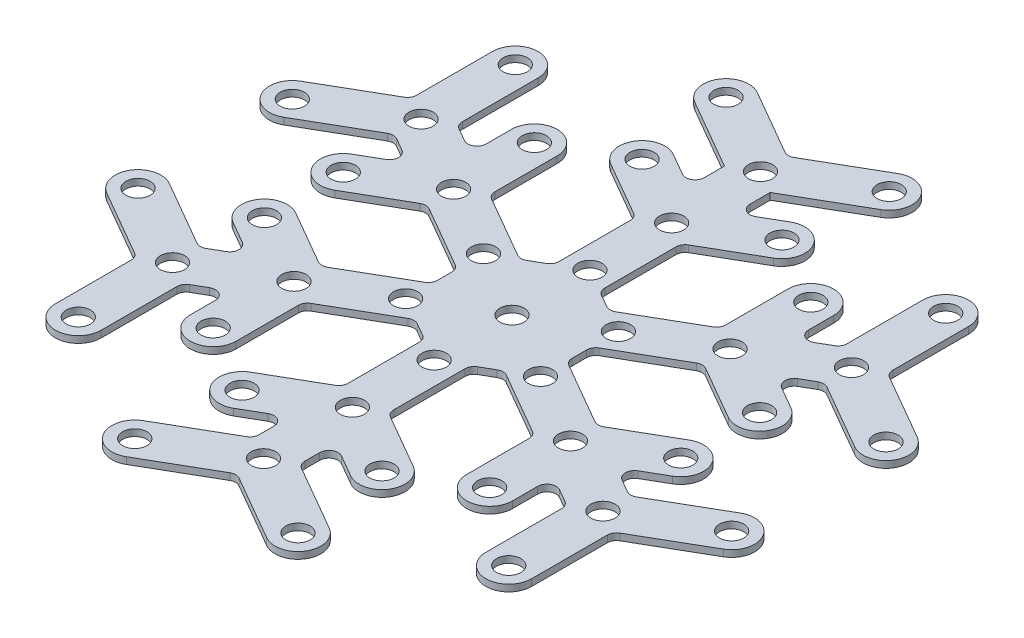
from build123d import *

# Parameters (mm, degrees)
SKETCH1_R           = 5.715
BOSS_EXTRUDE1_DEPTH = 3.175


with BuildPart() as part:
    # Sketch1 → Boss-Extrude1 (new body)
    with BuildSketch(Plane(origin=(0, 0, 0), x_dir=(1, 0, 0), z_dir=(0, 1, 0))):
        with BuildLine():
            Line((-33.097329198, 148.802026866), (-2.174864524, 130.948933563))
            ThreePointArc((-2.174864524, 130.948933563), (0, 130.36618037), (2.174864524, 130.948933563))
            Line((2.174864524, 130.948933563), (33.097329198, 148.802026866))
            ThreePointArc((33.097329198, 148.802026866), (47.843573432, 144.850782633), (43.892329198, 130.104538399))
            Line((43.892329198, 130.104538399), (10.795, 110.995786477))
            Line((10.795, 110.995786477), (10.795, 101.526203456))
            ThreePointArc((10.795, 101.526203456), (12.969864524, 97.759227601), (17.319593573, 97.759227601))
            Line((17.319593573, 97.759227601), (27.598067884, 103.693507511))
            ThreePointArc((27.598067884, 103.693507511), (42.344312118, 99.742263278), (38.393067884, 84.996019044))
            Line((38.393067884, 84.996019044), (12.969864524, 70.31792574))
            ThreePointArc((12.969864524, 70.31792574), (11.377753193, 68.725814409), (10.795, 66.550949885))
            Line((10.795, 66.550949885), (10.795, 33.009140551))
            ThreePointArc((10.795, 33.009140551), (11.377753193, 30.834276027), (12.969864524, 29.242164695))
            Line((12.969864524, 29.242164695), (18.839525226, 25.853314509))
            ThreePointArc((18.839525226, 25.853314509), (21.01438975, 25.270561316), (23.189254274, 25.853314509))
            Line((23.189254274, 25.853314509), (52.237313246, 42.624219176))
            ThreePointArc((52.237313246, 42.624219176), (53.829424577, 44.216330508), (54.41217777, 46.391195032))
            Line((54.41217777, 46.391195032), (54.41217777, 75.747381639))
            ThreePointArc((54.41217777, 75.747381639), (65.20717777, 86.542381639), (76.00217777, 75.747381639))
            Line((76.00217777, 75.747381639), (76.00217777, 63.878821818))
            ThreePointArc((76.00217777, 63.878821818), (78.177042295, 60.111845962), (82.526771343, 60.111845962))
            Line((82.526771343, 60.111845962), (88.552806278, 63.590978854))
            ThreePointArc((88.552806278, 63.590978854), (90.144917609, 65.183090185), (90.727670802, 67.357954709))
            Line((90.727670802, 67.357954709), (90.727670802, 103.064141316))
            ThreePointArc((90.727670802, 103.064141316), (101.522670802, 113.859141316), (112.317670802, 103.064141316))
            Line((112.317670802, 103.064141316), (112.317670802, 67.357954709))
            ThreePointArc((112.317670802, 67.357954709), (112.900423995, 65.183090185), (114.492535326, 63.590978854))
            Line((114.492535326, 63.590978854), (145.415, 45.73788555))
            ThreePointArc((145.415, 45.73788555), (149.366244234, 30.991641316), (134.62, 27.040397082))
            Line((134.62, 27.040397082), (103.697535326, 44.893490386))
            ThreePointArc((103.697535326, 44.893490386), (101.522670802, 45.476243579), (99.347806278, 44.893490386))
            Line((99.347806278, 44.893490386), (93.321771343, 41.414357494))
            ThreePointArc((93.321771343, 41.414357494), (91.146906819, 37.647381639), (93.321771343, 33.880405783))
            Line((93.321771343, 33.880405783), (103.600245655, 27.946125873))
            ThreePointArc((103.600245655, 27.946125873), (107.551489888, 13.199881639), (92.805245655, 9.248637405))
            Line((92.805245655, 9.248637405), (67.382042295, 23.926730708))
            ThreePointArc((67.382042295, 23.926730708), (65.20717777, 24.509483901), (63.032313246, 23.926730708))
            Line((63.032313246, 23.926730708), (33.984254274, 7.155826042))
            ThreePointArc((33.984254274, 7.155826042), (32.392142943, 5.56371471), (31.80938975, 3.388850186))
            Line((31.80938975, 3.388850186), (31.80938975, -3.388850186))
            ThreePointArc((31.80938975, -3.388850186), (32.392142943, -5.56371471), (33.984254274, -7.155826042))
            Line((33.984254274, -7.155826042), (63.032313246, -23.926730708))
            ThreePointArc((63.032313246, -23.926730708), (65.20717777, -24.509483901), (67.382042295, -23.926730708))
            Line((67.382042295, -23.926730708), (92.805245655, -9.248637405))
            ThreePointArc((92.805245655, -9.248637405), (107.551489888, -13.199881639), (103.600245655, -27.946125873))
            Line((103.600245655, -27.946125873), (93.321771343, -33.880405783))
            ThreePointArc((93.321771343, -33.880405783), (91.146906819, -37.647381639), (93.321771343, -41.414357494))
            Line((93.321771343, -41.414357494), (99.347806278, -44.893490386))
            ThreePointArc((99.347806278, -44.893490386), (101.522670802, -45.476243579), (103.697535326, -44.893490386))
            Line((103.697535326, -44.893490386), (134.62, -27.040397082))
            ThreePointArc((134.62, -27.040397082), (149.366244234, -30.991641316), (145.415, -45.73788555))
            Line((145.415, -45.73788555), (114.492535326, -63.590978854))
            ThreePointArc((114.492535326, -63.590978854), (112.900423995, -65.183090185), (112.317670802, -67.357954709))
            Line((112.317670802, -67.357954709), (112.317670802, -103.064141316))
            ThreePointArc((112.317670802, -103.064141316), (101.522670802, -113.859141316), (90.727670802, -103.064141316))
            Line((90.727670802, -103.064141316), (90.727670802, -67.357954709))
            ThreePointArc((90.727670802, -67.357954709), (90.144917609, -65.183090185), (88.552806278, -63.590978854))
            Line((88.552806278, -63.590978854), (82.526771343, -60.111845962))
            ThreePointArc((82.526771343, -60.111845962), (78.177042295, -60.111845962), (76.00217777, -63.878821818))
            Line((76.00217777, -63.878821818), (76.00217777, -75.747381639))
            ThreePointArc((76.00217777, -75.747381639), (65.20717777, -86.542381639), (54.41217777, -75.747381639))
            Line((54.41217777, -75.747381639), (54.41217777, -46.391195032))
            ThreePointArc((54.41217777, -46.391195032), (53.829424577, -44.216330508), (52.237313246, -42.624219176))
            Line((52.237313246, -42.624219176), (23.189254274, -25.853314509))
            ThreePointArc((23.189254274, -25.853314509), (21.01438975, -25.270561316), (18.839525226, -25.853314509))
            Line((18.839525226, -25.853314509), (12.969864524, -29.242164695))
            ThreePointArc((12.969864524, -29.242164695), (11.377753193, -30.834276027), (10.795, -33.009140551))
            Line((10.795, -33.009140551), (10.795, -66.550949885))
            ThreePointArc((10.795, -66.550949885), (11.377753193, -68.725814409), (12.969864524, -70.31792574))
            Line((12.969864524, -70.31792574), (38.393067884, -84.996019044))
            ThreePointArc((38.393067884, -84.996019044), (42.344312118, -99.742263278), (27.598067884, -103.693507511))
            Line((27.598067884, -103.693507511), (17.319593573, -97.759227601))
            ThreePointArc((17.319593573, -97.759227601), (12.969864524, -97.759227601), (10.795, -101.526203456))
            Line((10.795, -101.526203456), (10.795, -108.48446924))
            ThreePointArc((10.795, -108.48446924), (11.377753193, -110.659333764), (12.969864524, -112.251445095))
            Line((12.969864524, -112.251445095), (43.892329198, -130.104538399))
            ThreePointArc((43.892329198, -130.104538399), (47.843573432, -144.850782633), (33.097329198, -148.802026866))
            Line((33.097329198, -148.802026866), (2.174864524, -130.948933563))
            ThreePointArc((2.174864524, -130.948933563), (0, -130.36618037), (-2.174864524, -130.948933563))
            Line((-2.174864524, -130.948933563), (-33.097329198, -148.802026866))
            ThreePointArc((-33.097329198, -148.802026866), (-47.843573432, -144.850782633), (-43.892329198, -130.104538399))
            Line((-43.892329198, -130.104538399), (-12.969864524, -112.251445095))
            ThreePointArc((-12.969864524, -112.251445095), (-11.377753193, -110.659333764), (-10.795, -108.48446924))
            Line((-10.795, -108.48446924), (-10.795, -101.526203456))
            ThreePointArc((-10.795, -101.526203456), (-12.969864524, -97.759227601), (-17.319593573, -97.759227601))
            Line((-17.319593573, -97.759227601), (-27.598067884, -103.693507511))
            ThreePointArc((-27.598067884, -103.693507511), (-42.344312118, -99.742263278), (-38.393067884, -84.996019044))
            Line((-38.393067884, -84.996019044), (-12.969864524, -70.31792574))
            ThreePointArc((-12.969864524, -70.31792574), (-11.377753193, -68.725814409), (-10.795, -66.550949885))
            Line((-10.795, -66.550949885), (-10.795, -33.009140551))
            ThreePointArc((-10.795, -33.009140551), (-11.377753193, -30.834276027), (-12.969864524, -29.242164695))
            Line((-12.969864524, -29.242164695), (-18.839525226, -25.853314509))
            ThreePointArc((-18.839525226, -25.853314509), (-21.01438975, -25.270561316), (-23.189254274, -25.853314509))
            Line((-23.189254274, -25.853314509), (-52.237313246, -42.624219176))
            ThreePointArc((-52.237313246, -42.624219176), (-53.829424577, -44.216330508), (-54.41217777, -46.391195032))
            Line((-54.41217777, -46.391195032), (-54.41217777, -75.747381639))
            ThreePointArc((-54.41217777, -75.747381639), (-65.20717777, -86.542381639), (-76.00217777, -75.747381639))
            Line((-76.00217777, -75.747381639), (-76.00217777, -63.878821818))
            ThreePointArc((-76.00217777, -63.878821818), (-78.177042295, -60.111845962), (-82.526771343, -60.111845962))
            Line((-82.526771343, -60.111845962), (-88.552806278, -63.590978854))
            ThreePointArc((-88.552806278, -63.590978854), (-90.144917609, -65.183090185), (-90.727670802, -67.357954709))
            Line((-90.727670802, -67.357954709), (-90.727670802, -103.064141316))
            ThreePointArc((-90.727670802, -103.064141316), (-101.522670802, -113.859141316), (-112.317670802, -103.064141316))
            Line((-112.317670802, -103.064141316), (-112.317670802, -67.357954709))
            ThreePointArc((-112.317670802, -67.357954709), (-112.900423995, -65.183090185), (-114.492535326, -63.590978854))
            Line((-114.492535326, -63.590978854), (-145.415, -45.73788555))
            ThreePointArc((-145.415, -45.73788555), (-149.366244234, -30.991641316), (-134.62, -27.040397082))
            Line((-134.62, -27.040397082), (-103.697535326, -44.893490386))
            ThreePointArc((-103.697535326, -44.893490386), (-101.522670802, -45.476243579), (-99.347806278, -44.893490386))
            Line((-99.347806278, -44.893490386), (-93.321771343, -41.414357494))
            ThreePointArc((-93.321771343, -41.414357494), (-91.146906819, -37.647381639), (-93.321771343, -33.880405783))
            Line((-93.321771343, -33.880405783), (-103.600245655, -27.946125873))
            ThreePointArc((-103.600245655, -27.946125873), (-107.551489888, -13.199881639), (-92.805245655, -9.248637405))
            Line((-92.805245655, -9.248637405), (-67.382042295, -23.926730708))
            ThreePointArc((-67.382042295, -23.926730708), (-65.20717777, -24.509483901), (-63.032313246, -23.926730708))
            Line((-63.032313246, -23.926730708), (-33.984254274, -7.155826042))
            ThreePointArc((-33.984254274, -7.155826042), (-32.392142943, -5.56371471), (-31.80938975, -3.388850186))
            Line((-31.80938975, -3.388850186), (-31.80938975, 3.388850186))
            ThreePointArc((-31.80938975, 3.388850186), (-32.392142943, 5.56371471), (-33.984254274, 7.155826042))
            Line((-33.984254274, 7.155826042), (-63.032313246, 23.926730708))
            ThreePointArc((-63.032313246, 23.926730708), (-65.20717777, 24.509483901), (-67.382042295, 23.926730708))
            Line((-67.382042295, 23.926730708), (-92.805245655, 9.248637405))
            ThreePointArc((-92.805245655, 9.248637405), (-107.551489888, 13.199881639), (-103.600245655, 27.946125873))
            Line((-103.600245655, 27.946125873), (-93.321771343, 33.880405783))
            ThreePointArc((-93.321771343, 33.880405783), (-91.146906819, 37.647381639), (-93.321771343, 41.414357494))
            Line((-93.321771343, 41.414357494), (-99.347806278, 44.893490386))
            ThreePointArc((-99.347806278, 44.893490386), (-101.522670802, 45.476243579), (-103.697535326, 44.893490386))
            Line((-103.697535326, 44.893490386), (-134.62, 27.040397082))
            ThreePointArc((-134.62, 27.040397082), (-149.366244234, 30.991641316), (-145.415, 45.73788555))
            Line((-145.415, 45.73788555), (-114.492535326, 63.590978854))
            ThreePointArc((-114.492535326, 63.590978854), (-112.900423995, 65.183090185), (-112.317670802, 67.357954709))
            Line((-112.317670802, 67.357954709), (-112.317670802, 103.064141316))
            ThreePointArc((-112.317670802, 103.064141316), (-101.522670802, 113.859141316), (-90.727670802, 103.064141316))
            Line((-90.727670802, 103.064141316), (-90.727670802, 67.357954709))
            ThreePointArc((-90.727670802, 67.357954709), (-90.144917609, 65.183090185), (-88.552806278, 63.590978854))
            Line((-88.552806278, 63.590978854), (-82.526771343, 60.111845962))
            ThreePointArc((-82.526771343, 60.111845962), (-78.177042295, 60.111845962), (-76.00217777, 63.878821818))
            Line((-76.00217777, 63.878821818), (-76.00217777, 75.747381639))
            ThreePointArc((-76.00217777, 75.747381639), (-65.20717777, 86.542381639), (-54.41217777, 75.747381639))
            Line((-54.41217777, 75.747381639), (-54.41217777, 46.391195032))
            ThreePointArc((-54.41217777, 46.391195032), (-53.829424577, 44.216330508), (-52.237313246, 42.624219176))
            Line((-52.237313246, 42.624219176), (-23.189254274, 25.853314509))
            ThreePointArc((-23.189254274, 25.853314509), (-21.01438975, 25.270561316), (-18.839525226, 25.853314509))
            Line((-18.839525226, 25.853314509), (-12.969864524, 29.242164695))
            ThreePointArc((-12.969864524, 29.242164695), (-11.377753193, 30.834276027), (-10.795, 33.009140551))
            Line((-10.795, 33.009140551), (-10.795, 66.550949885))
            ThreePointArc((-10.795, 66.550949885), (-11.377753193, 68.725814409), (-12.969864524, 70.31792574))
            Line((-12.969864524, 70.31792574), (-38.393067884, 84.996019044))
            ThreePointArc((-38.393067884, 84.996019044), (-42.344312118, 99.742263278), (-27.598067884, 103.693507511))
            Line((-27.598067884, 103.693507511), (-17.319593573, 97.759227601))
            ThreePointArc((-17.319593573, 97.759227601), (-12.969864524, 97.759227601), (-10.795, 101.526203456))
            Line((-10.795, 101.526203456), (-10.795, 110.995786477))
            Line((-10.795, 110.995786477), (-43.892329198, 130.104538399))
            ThreePointArc((-43.892329198, 130.104538399), (-47.843573432, 144.850782633), (-33.097329198, 148.802026866))
        make_face()
        with Locations(Location((0, 117.228282633, 0), (0, 0, 270))):
            Circle(SKETCH1_R, mode=Mode.SUBTRACT)
        with Locations(Location((38.494829198, 139.453282633, 0), (0, 0, 270))):
            Circle(SKETCH1_R, mode=Mode.SUBTRACT)
        with Locations(Location((-38.494829198, 139.453282633, 0), (0, 0, 270))):
            Circle(SKETCH1_R, mode=Mode.SUBTRACT)
        with Locations(Location((-32.995567884, 94.344763278, 0), (0, 0, 270))):
            Circle(SKETCH1_R, mode=Mode.SUBTRACT)
        with Locations(Location((32.995567884, 94.344763278, 0), (0, 0, 270))):
            Circle(SKETCH1_R, mode=Mode.SUBTRACT)
        with Locations(Location((101.522670802, 58.614141316, 0), (0, 0, 270))):
            Circle(SKETCH1_R, mode=Mode.SUBTRACT)
        with Locations(Location((140.0175, 36.389141316, 0), (0, 0, 270))):
            Circle(SKETCH1_R, mode=Mode.SUBTRACT)
        with Locations(Location((101.522670802, 103.064141316, 0), (0, 0, 270))):
            Circle(SKETCH1_R, mode=Mode.SUBTRACT)
        with Locations(Location((65.20717777, 75.747381639, 0), (0, 0, 270))):
            Circle(SKETCH1_R, mode=Mode.SUBTRACT)
        with Locations(Location((98.202745655, 18.597381639, 0), (0, 0, 270))):
            Circle(SKETCH1_R, mode=Mode.SUBTRACT)
        with Locations(Location((101.522670802, -58.614141316, 0), (0, 0, 270))):
            Circle(SKETCH1_R, mode=Mode.SUBTRACT)
        with Locations(Location((101.522670802, -103.064141316, 0), (0, 0, 270))):
            Circle(SKETCH1_R, mode=Mode.SUBTRACT)
        with Locations(Location((140.0175, -36.389141316, 0), (0, 0, 270))):
            Circle(SKETCH1_R, mode=Mode.SUBTRACT)
        with Locations(Location((98.202745655, -18.597381639, 0), (0, 0, 270))):
            Circle(SKETCH1_R, mode=Mode.SUBTRACT)
        with Locations(Location((65.20717777, -75.747381639, 0), (0, 0, 270))):
            Circle(SKETCH1_R, mode=Mode.SUBTRACT)
        with Locations(Location((0, -117.228282633, 0), (0, 0, 270))):
            Circle(SKETCH1_R, mode=Mode.SUBTRACT)
        with Locations(Location((-38.494829198, -139.453282633, 0), (0, 0, 270))):
            Circle(SKETCH1_R, mode=Mode.SUBTRACT)
        with Locations(Location((38.494829198, -139.453282633, 0), (0, 0, 270))):
            Circle(SKETCH1_R, mode=Mode.SUBTRACT)
        with Locations(Location((32.995567884, -94.344763278, 0), (0, 0, 270))):
            Circle(SKETCH1_R, mode=Mode.SUBTRACT)
        with Locations(Location((-32.995567884, -94.344763278, 0), (0, 0, 270))):
            Circle(SKETCH1_R, mode=Mode.SUBTRACT)
        with Locations(Location((-101.522670802, -58.614141316, 0), (0, 0, 270))):
            Circle(SKETCH1_R, mode=Mode.SUBTRACT)
        with Locations(Location((-140.0175, -36.389141316, 0), (0, 0, 270))):
            Circle(SKETCH1_R, mode=Mode.SUBTRACT)
        with Locations(Location((-101.522670802, -103.064141316, 0), (0, 0, 270))):
            Circle(SKETCH1_R, mode=Mode.SUBTRACT)
        with Locations(Location((-65.20717777, -75.747381639, 0), (0, 0, 270))):
            Circle(SKETCH1_R, mode=Mode.SUBTRACT)
        with Locations(Location((-98.202745655, -18.597381639, 0), (0, 0, 270))):
            Circle(SKETCH1_R, mode=Mode.SUBTRACT)
        with Locations(Location((-101.522670802, 58.614141316, 0), (0, 0, 270))):
            Circle(SKETCH1_R, mode=Mode.SUBTRACT)
        with Locations(Location((-101.522670802, 103.064141316, 0), (0, 0, 270))):
            Circle(SKETCH1_R, mode=Mode.SUBTRACT)
        with Locations(Location((-140.0175, 36.389141316, 0), (0, 0, 270))):
            Circle(SKETCH1_R, mode=Mode.SUBTRACT)
        with Locations(Location((-98.202745655, 18.597381639, 0), (0, 0, 270))):
            Circle(SKETCH1_R, mode=Mode.SUBTRACT)
        with Locations(Location((-65.20717777, 75.747381639, 0), (0, 0, 270))):
            Circle(SKETCH1_R, mode=Mode.SUBTRACT)
        with Locations(Location((-65.20717777, 37.647381639, 0), (0, 0, 270))):
            Circle(SKETCH1_R, mode=Mode.SUBTRACT)
        with Locations(Location((0, 75.294763278, 0), (0, 0, 270))):
            Circle(SKETCH1_R, mode=Mode.SUBTRACT)
        with Locations(Location((65.20717777, 37.647381639, 0), (0, 0, 270))):
            Circle(SKETCH1_R, mode=Mode.SUBTRACT)
        with Locations(Location((65.20717777, -37.647381639, 0), (0, 0, 270))):
            Circle(SKETCH1_R, mode=Mode.SUBTRACT)
        with Locations(Location((0, -75.294763278, 0), (0, 0, 270))):
            Circle(SKETCH1_R, mode=Mode.SUBTRACT)
        with Locations(Location((-65.20717777, -37.647381639, 0), (0, 0, 270))):
            Circle(SKETCH1_R, mode=Mode.SUBTRACT)
        with Locations(Location((0, 0, 0), (0, 0, 270))):
            Circle(SKETCH1_R, mode=Mode.SUBTRACT)
        with Locations(Location((31.80938975, -18.365159735, 0), (0, 0, 270))):
            Circle(SKETCH1_R, mode=Mode.SUBTRACT)
        with Locations(Location((0, 36.73031947, 0), (0, 0, 270))):
            Circle(SKETCH1_R, mode=Mode.SUBTRACT)
        with Locations(Location((-31.80938975, -18.365159735, 0), (0, 0, 270))):
            Circle(SKETCH1_R, mode=Mode.SUBTRACT)
        with Locations(Location((-31.80938975, 18.365159735, 0), (0, 0, 270))):
            Circle(SKETCH1_R, mode=Mode.SUBTRACT)
        with Locations(Location((0, -36.73031947, 0), (0, 0, 270))):
            Circle(SKETCH1_R, mode=Mode.SUBTRACT)
        with Locations(Location((31.80938975, 18.365159735, 0), (0, 0, 270))):
            Circle(SKETCH1_R, mode=Mode.SUBTRACT)
    extrude(amount=BOSS_EXTRUDE1_DEPTH)


solid = part.part
